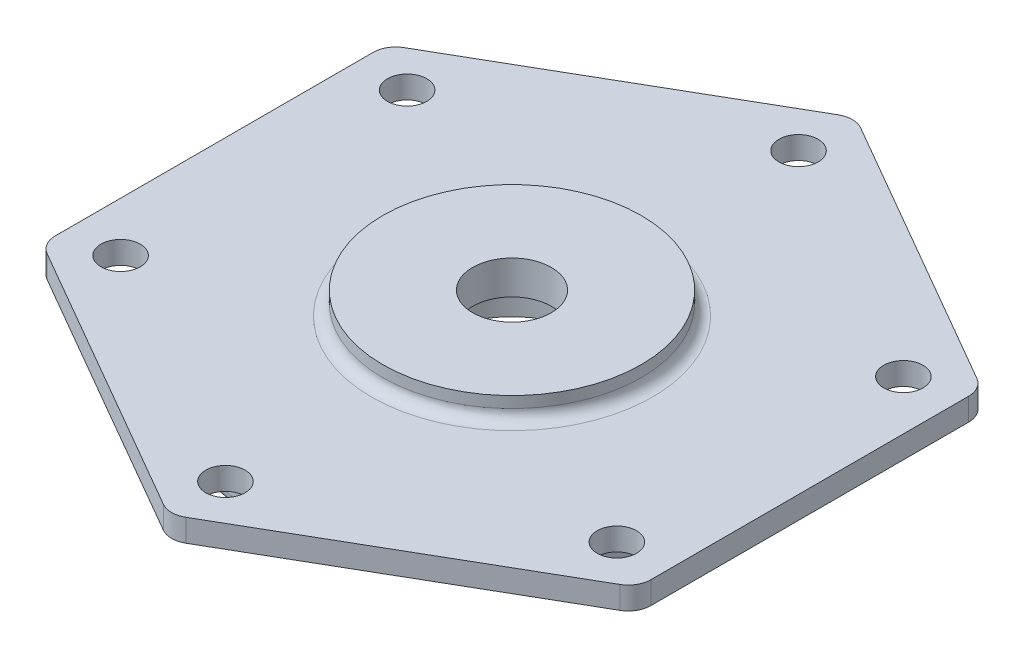
from build123d import *

# Parameters (mm, degrees)
BOSS_EXTRUDE1_DEPTH = 4
SKETCH2_R           = 23
BOSS_EXTRUDE2_DEPTH = 4
SKETCH3_R           = 45
BOSS_EXTRUDE3_DEPTH = 6
SKETCH4_R           = 40
SKETCH4_R_2         = 19
CUT_EXTRUDE1_DEPTH  = 6
SKETCH5_R           = 14
CUT_EXTRUDE2_DEPTH  = 8
SKETCH6_R           = 7
CUT_EXTRUDE3_DEPTH  = 81.888663881
FILLET2_R           = 2
SKETCH7_R           = 3.5
CUT_EXTRUDE4_DEPTH  = 82.110886719


with BuildPart() as part:
    # Sketch1 → Boss-Extrude1 (new body)
    with BuildSketch(Plane(origin=(0, 0, 0), x_dir=(1, 0, 0), z_dir=(0, 1, 0))):
        with BuildLine():
            Line((-2, 60.044427996), (-51, 31.754264805))
            ThreePointArc((-51, 31.754264805), (-52.464101615, 30.29016319), (-53, 28.29016319))
            Line((-53, 28.29016319), (-53, -28.29016319))
            ThreePointArc((-53, -28.29016319), (-52.464101615, -30.29016319), (-51, -31.754264805))
            Line((-51, -31.754264805), (-2, -60.044427996))
            ThreePointArc((-2, -60.044427996), (0, -60.580326381), (2, -60.044427996))
            Line((2, -60.044427996), (51, -31.754264805))
            ThreePointArc((51, -31.754264805), (52.464101615, -30.29016319), (53, -28.29016319))
            Line((53, -28.29016319), (53, 28.29016319))
            ThreePointArc((53, 28.29016319), (52.464101615, 30.29016319), (51, 31.754264805))
            Line((51, 31.754264805), (2, 60.044427996))
            ThreePointArc((2, 60.044427996), (0, 60.580326381), (-2, 60.044427996))
        make_face()
    extrude(amount=BOSS_EXTRUDE1_DEPTH)

    # Sketch2 → Boss-Extrude2 (add)
    with BuildSketch(Plane(origin=(0, 4, 0), x_dir=(1, 0, 0), z_dir=(0, 1, 0))):
        with Locations(Location((0, 0, 0), (0, 0, 270))):
            Circle(SKETCH2_R)
    extrude(amount=BOSS_EXTRUDE2_DEPTH)

    # Sketch3 → Boss-Extrude3 (add)
    with BuildSketch(Plane.XZ):
        with Locations(Location((0, 0, 0), (0, 0, 270))):
            Circle(SKETCH3_R)
    extrude(amount=BOSS_EXTRUDE3_DEPTH)

    # Sketch4 → Cut-Extrude1 (cut)
    with BuildSketch(Plane(origin=(0, -6, 0), x_dir=(-1, 0, 0), z_dir=(0, -1, 0))):
        with Locations(Location((0, 0, 0), (0, 0, 90))):
            Circle(SKETCH4_R)
        with Locations(Location((0, 0, 0), (0, 0, 90))):
            Circle(SKETCH4_R_2, mode=Mode.SUBTRACT)
    extrude(amount=-CUT_EXTRUDE1_DEPTH, mode=Mode.SUBTRACT)

    # Sketch5 → Cut-Extrude2 (cut)
    with BuildSketch(Plane.XZ.offset(6)):
        with Locations(Location((0, 0, 0), (0, 0, 270))):
            Circle(SKETCH5_R)
    extrude(amount=-CUT_EXTRUDE2_DEPTH, mode=Mode.SUBTRACT)

    # Sketch6 → Cut-Extrude3 (cut, through all)
    with BuildSketch(Plane(origin=(0, 2, 0), x_dir=(-1, 0, 0), z_dir=(0, -1, 0))):
        with Locations(Location((0, 0, 0), (0, 0, 90))):
            Circle(SKETCH6_R)
    extrude(amount=-CUT_EXTRUDE3_DEPTH, mode=Mode.SUBTRACT)

    # Fillet2
    fillet2_edges = [part.edges().sort_by_distance(p)[0] for p in [
        (0, 4, -23),
        (0, -6, 45),
        (0, -6, 19),
    ]]
    fillet(fillet2_edges, radius=FILLET2_R)

    # Sketch7 → Cut-Extrude4 (cut, through all)
    with BuildSketch(Plane(origin=(0, 4, 0), x_dir=(1, 0, 0), z_dir=(0, 1, 0))):
        with Locations(Location((0, 51, 0), (0, 0, 270))):
            Circle(SKETCH7_R)
        with Locations(Location((44.167295593, 25.5, 0), (0, 0, 270))):
            Circle(SKETCH7_R)
        with Locations(Location((44.167295593, -25.5, 0), (0, 0, 270))):
            Circle(SKETCH7_R)
        with Locations(Location((0, -51, 0), (0, 0, 270))):
            Circle(SKETCH7_R)
        with Locations(Location((-44.167295593, -25.5, 0), (0, 0, 270))):
            Circle(SKETCH7_R)
        with Locations(Location((-44.167295593, 25.5, 0), (0, 0, 270))):
            Circle(SKETCH7_R)
    extrude(amount=-CUT_EXTRUDE4_DEPTH, mode=Mode.SUBTRACT)


solid = part.part
